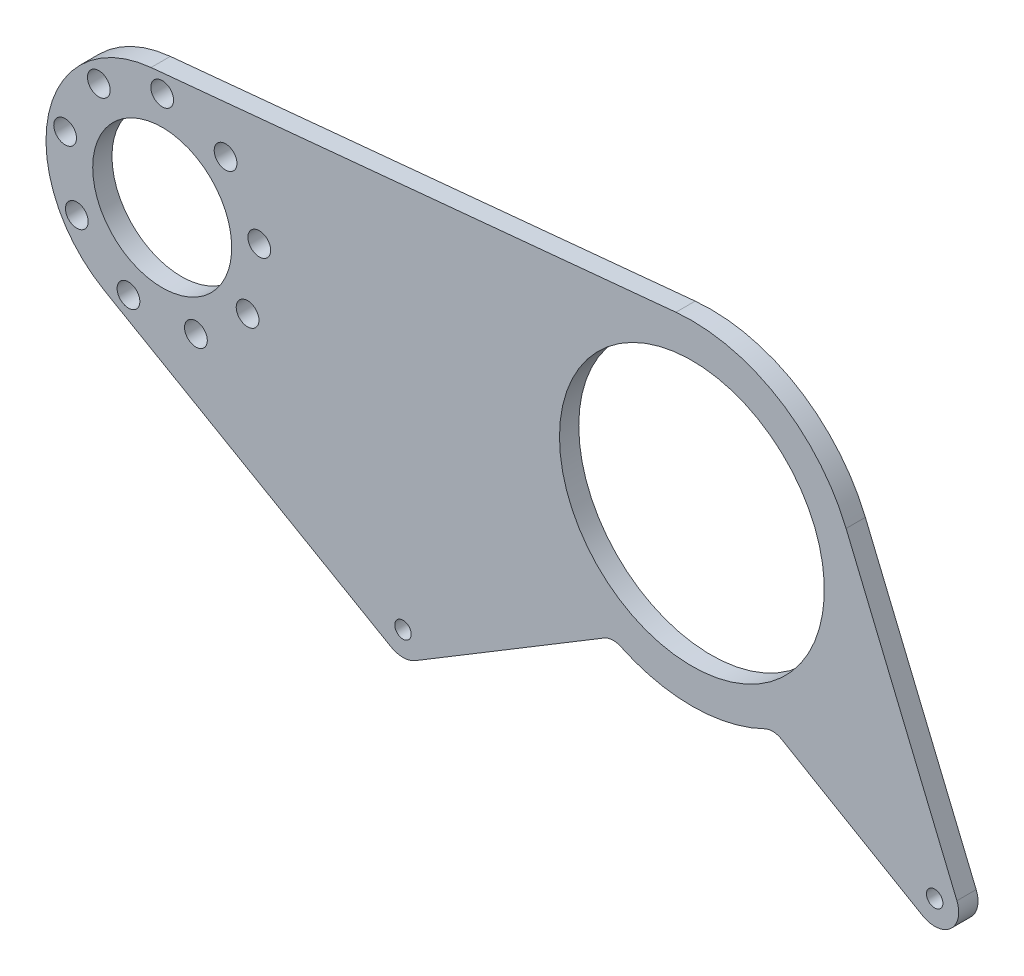
from build123d import *

# Parameters (mm, degrees)
SKETCH1_R           = 27.4955
SKETCH1_R_2         = 52.3875
SKETCH1_R_3         = 3.2512
SKETCH1_R_4         = 4.49961
BOSS_EXTRUDE1_DEPTH = 7.62


with BuildPart() as part:
    # Sketch1 → Boss-Extrude1 (new body)
    with BuildSketch(Plane.XY):
        with BuildLine():
            Line((-328.252358788, 147.362734983), (-120.623830303, 167.33652539))
            ThreePointArc((-120.623830303, 167.33652539), (-80.305183306, 158.218318925), (-53.30558743, 126.917251733))
            Line((-53.30558743, 126.917251733), (-9.46754648, 21.302488163))
            ThreePointArc((-9.46754648, 21.302488163), (-11.996916286, 10.47886003), (-23.061809086, 9.422079593))
            Line((-23.061809086, 9.422079593), (-78.866488962, 41.953179506))
            ThreePointArc((-78.866488962, 41.953179506), (-82.120777387, 42.89869406), (-85.437090509, 42.2012285))
            ThreePointArc((-85.437090509, 42.2012285), (-113.899521097, 35.561214301), (-142.440389403, 41.855543485))
            ThreePointArc((-142.440389403, 41.855543485), (-145.776424621, 42.51215325), (-149.027245523, 41.515945031))
            Line((-149.027245523, 41.515945031), (-223.676633484, -3.557736497))
            ThreePointArc((-223.676633484, -3.557736497), (-228.504182895, -4.928354428), (-233.358329437, -3.655134819))
            Line((-233.358329437, -3.655134819), (-346.816870084, 61.773732857))
            ThreePointArc((-346.816870084, 61.773732857), (-368.77925543, 111.345290274), (-328.252358788, 147.362734983))
        make_face()
        with Locations(Location((-323.85, 101.6, 0), (0, 0, 180))):
            Circle(SKETCH1_R, mode=Mode.SUBTRACT)
        with Locations(Location((-114.3, 101.6, 0), (0, 0, 180))):
            Circle(SKETCH1_R_2, mode=Mode.SUBTRACT)
        with Locations(Location((-228.6, 4.596163622, 0), (0, 0, 180))):
            Circle(SKETCH1_R_3, mode=Mode.SUBTRACT)
        with Locations(Location((-18.264817524, 17.65096147, 0), (0, 0, 180))):
            Circle(SKETCH1_R_3, mode=Mode.SUBTRACT)
        with Locations(Location((-323.85, 140.59916, 0), (0, 0, 180))):
            Circle(SKETCH1_R_4, mode=Mode.SUBTRACT)
        with Locations(Location((-298.781823164, 131.475089804, 0), (0, 0, 180))):
            Circle(SKETCH1_R_4, mode=Mode.SUBTRACT)
        with Locations(Location((-285.443324871, 108.372133065, 0), (0, 0, 180))):
            Circle(SKETCH1_R_4, mode=Mode.SUBTRACT)
        with Locations(Location((-290.075736714, 82.10042, 0), (0, 0, 180))):
            Circle(SKETCH1_R_4, mode=Mode.SUBTRACT)
        with Locations(Location((-310.511501707, 64.952777131, 0), (0, 0, 180))):
            Circle(SKETCH1_R_4, mode=Mode.SUBTRACT)
        with Locations(Location((-337.188498293, 64.952777131, 0), (0, 0, 180))):
            Circle(SKETCH1_R_4, mode=Mode.SUBTRACT)
        with Locations(Location((-357.624263286, 82.10042, 0), (0, 0, 180))):
            Circle(SKETCH1_R_4, mode=Mode.SUBTRACT)
        with Locations(Location((-362.256675129, 108.372133065, 0), (0, 0, 180))):
            Circle(SKETCH1_R_4, mode=Mode.SUBTRACT)
        with Locations(Location((-348.918176836, 131.475089804, 0), (0, 0, 180))):
            Circle(SKETCH1_R_4, mode=Mode.SUBTRACT)
    extrude(amount=BOSS_EXTRUDE1_DEPTH)


solid = part.part
